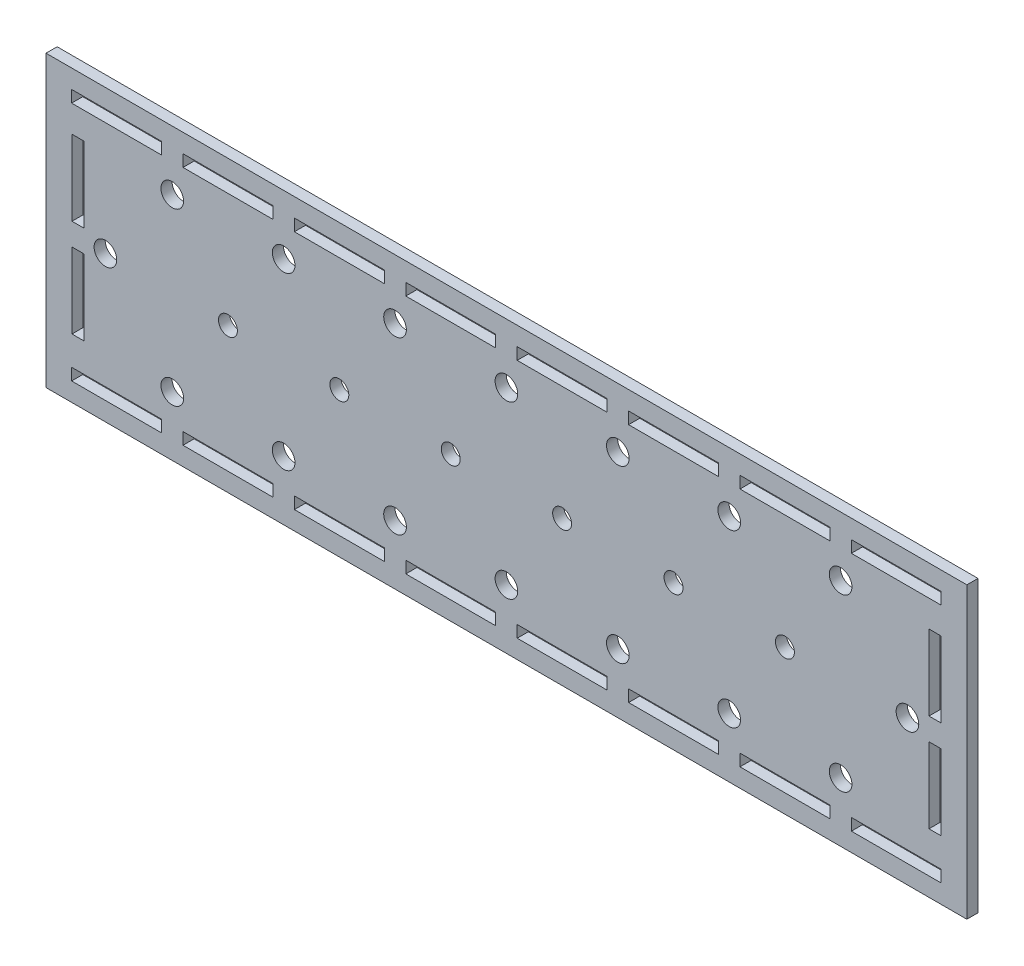
from build123d import *

# Parameters (mm, degrees)
SKETCH1_W           = 248
SKETCH1_H           = 78
SKETCH1_R           = 3.05
SKETCH1_W_2         = 24.2
SKETCH1_H_2         = 3.2
SKETCH1_W_3         = 3.2
SKETCH1_H_3         = 20.3
BOSS_EXTRUDE2_DEPTH = 3
SKETCH5_R           = 2.55
CUT_EXTRUDE1_DEPTH  = 10


with BuildPart() as part:
    # Sketch1 → Boss-Extrude2 (new body)
    with BuildSketch(Plane(origin=(0, 0, 0), x_dir=(-1, 0, 0), z_dir=(0, 0, 1))):
        with Locations((-428.787224347, 459)):
            Rectangle(SKETCH1_W, SKETCH1_H)
        with Locations(Location((-338.787224347, 436, 0), (0, 0, 180))):
            Circle(SKETCH1_R, mode=Mode.SUBTRACT)
        with Locations(Location((-368.787224347, 436, 0), (0, 0, 180))):
            Circle(SKETCH1_R, mode=Mode.SUBTRACT)
        with Locations(Location((-428.787224347, 436, 0), (0, 0, 180))):
            Circle(SKETCH1_R, mode=Mode.SUBTRACT)
        with Locations(Location((-398.787224347, 436, 0), (0, 0, 180))):
            Circle(SKETCH1_R, mode=Mode.SUBTRACT)
        with Locations(Location((-488.787224347, 436, 0), (0, 0, 180))):
            Circle(SKETCH1_R, mode=Mode.SUBTRACT)
        with Locations(Location((-458.787224347, 436, 0), (0, 0, 180))):
            Circle(SKETCH1_R, mode=Mode.SUBTRACT)
        with Locations(Location((-458.787224347, 482, 0), (0, 0, 180))):
            Circle(SKETCH1_R, mode=Mode.SUBTRACT)
        with Locations(Location((-428.787224347, 482, 0), (0, 0, 180))):
            Circle(SKETCH1_R, mode=Mode.SUBTRACT)
        with Locations(Location((-398.787224347, 482, 0), (0, 0, 180))):
            Circle(SKETCH1_R, mode=Mode.SUBTRACT)
        with Locations(Location((-368.787224347, 482, 0), (0, 0, 180))):
            Circle(SKETCH1_R, mode=Mode.SUBTRACT)
        with Locations(Location((-338.787224347, 482, 0), (0, 0, 180))):
            Circle(SKETCH1_R, mode=Mode.SUBTRACT)
        with Locations(Location((-320.787224347, 458.7, 0), (0, 0, 180))):
            Circle(SKETCH1_R, mode=Mode.SUBTRACT)
        with Locations(Location((-488.787224347, 482, 0), (0, 0, 180))):
            Circle(SKETCH1_R, mode=Mode.SUBTRACT)
        with Locations(Location((-518.787224347, 436, 0), (0, 0, 180))):
            Circle(SKETCH1_R, mode=Mode.SUBTRACT)
        with Locations(Location((-536.787224347, 459, 0), (0, 0, 180))):
            Circle(SKETCH1_R, mode=Mode.SUBTRACT)
        with Locations(Location((-518.787224347, 482, 0), (0, 0, 180))):
            Circle(SKETCH1_R, mode=Mode.SUBTRACT)
        with Locations((-383.787224347, 491.4)):
            Rectangle(SKETCH1_W_2, SKETCH1_H_2, mode=Mode.SUBTRACT)
        with Locations((-413.787224347, 491.4)):
            Rectangle(SKETCH1_W_2, SKETCH1_H_2, mode=Mode.SUBTRACT)
        with Locations((-353.787224347, 491.4)):
            Rectangle(SKETCH1_W_2, SKETCH1_H_2, mode=Mode.SUBTRACT)
        with Locations((-443.787224347, 491.4)):
            Rectangle(SKETCH1_W_2, SKETCH1_H_2, mode=Mode.SUBTRACT)
        with Locations((-473.787224347, 491.4)):
            Rectangle(SKETCH1_W_2, SKETCH1_H_2, mode=Mode.SUBTRACT)
        with Locations((-503.787224347, 491.4)):
            Rectangle(SKETCH1_W_2, SKETCH1_H_2, mode=Mode.SUBTRACT)
        with Locations((-533.787224347, 491.4)):
            Rectangle(SKETCH1_W_2, SKETCH1_H_2, mode=Mode.SUBTRACT)
        with Locations((-323.787224347, 491.4)):
            Rectangle(SKETCH1_W_2, SKETCH1_H_2, mode=Mode.SUBTRACT)
        with Locations((-313.387224347, 445.55)):
            Rectangle(SKETCH1_W_3, SKETCH1_H_3, mode=Mode.SUBTRACT)
        with Locations((-313.387224347, 471.85)):
            Rectangle(SKETCH1_W_3, SKETCH1_H_3, mode=Mode.SUBTRACT)
        with Locations((-544.187224347, 445.55)):
            Rectangle(SKETCH1_W_3, SKETCH1_H_3, mode=Mode.SUBTRACT)
        with Locations((-544.187224347, 471.85)):
            Rectangle(SKETCH1_W_3, SKETCH1_H_3, mode=Mode.SUBTRACT)
        with Locations((-533.787224347, 426.6)):
            Rectangle(SKETCH1_W_2, SKETCH1_H_2, mode=Mode.SUBTRACT)
        with Locations((-503.787224347, 426.6)):
            Rectangle(SKETCH1_W_2, SKETCH1_H_2, mode=Mode.SUBTRACT)
        with Locations((-473.787224347, 426.6)):
            Rectangle(SKETCH1_W_2, SKETCH1_H_2, mode=Mode.SUBTRACT)
        with Locations((-443.787224347, 426.6)):
            Rectangle(SKETCH1_W_2, SKETCH1_H_2, mode=Mode.SUBTRACT)
        with Locations((-413.787224347, 426.6)):
            Rectangle(SKETCH1_W_2, SKETCH1_H_2, mode=Mode.SUBTRACT)
        with Locations((-383.787224347, 426.6)):
            Rectangle(SKETCH1_W_2, SKETCH1_H_2, mode=Mode.SUBTRACT)
        with Locations((-353.787224347, 426.6)):
            Rectangle(SKETCH1_W_2, SKETCH1_H_2, mode=Mode.SUBTRACT)
        with Locations((-323.787224347, 426.6)):
            Rectangle(SKETCH1_W_2, SKETCH1_H_2, mode=Mode.SUBTRACT)
    extrude(amount=BOSS_EXTRUDE2_DEPTH)

    # Sketch5 → Cut-Extrude1 (cut)
    with BuildSketch(Plane.XY.offset(3)):
        with Locations((353.787224347, -459)):
            Circle(SKETCH5_R)
        with Locations((383.787224347, -459)):
            Circle(SKETCH5_R)
        with Locations((413.787224347, -459)):
            Circle(SKETCH5_R)
        with Locations((443.787224347, -459)):
            Circle(SKETCH5_R)
        with Locations((473.787224347, -459)):
            Circle(SKETCH5_R)
        with Locations((503.787224347, -459)):
            Circle(SKETCH5_R)
    extrude(amount=-CUT_EXTRUDE1_DEPTH, mode=Mode.SUBTRACT)


solid = part.part
